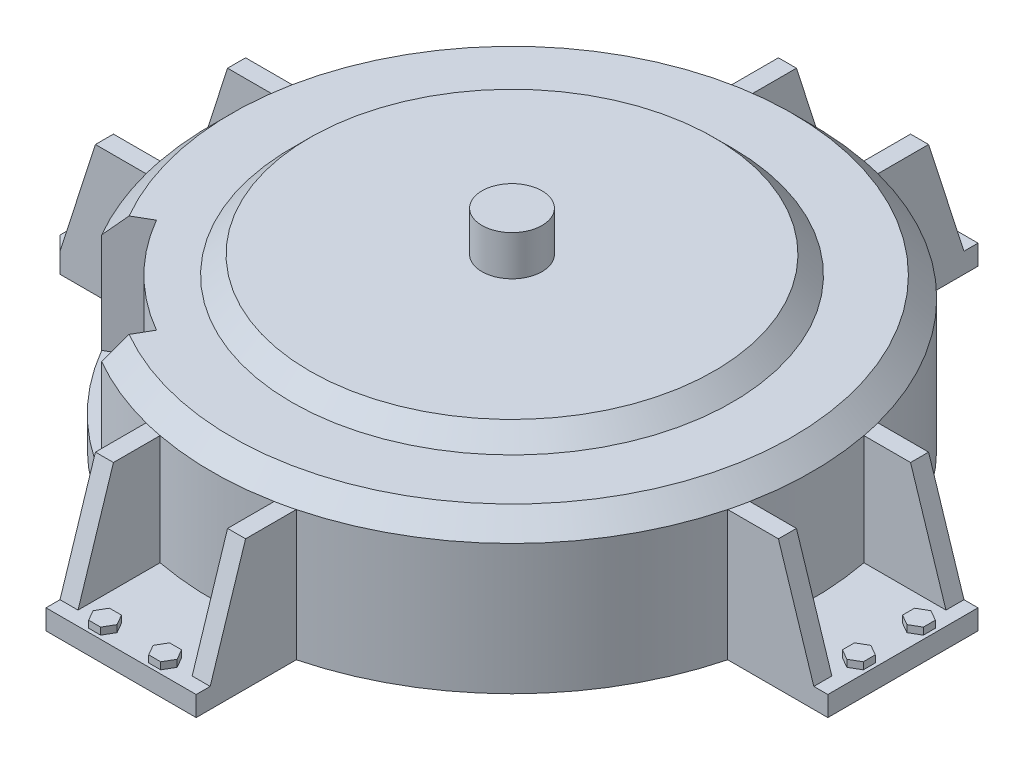
from build123d import *

# Parameters (mm, degrees)
SKETCH2_R                = 150
BOSS_EXTRUDE1_DEPTH      = 75
CHAMFER1_SIZE            = 10
BOSS_EXTRUDE2_START      = -75
BOSS_EXTRUDE2_DEPTH      = 10
CHAMFER2_SIZE            = 7
BOSS_EXTRUDE3_DEPTH      = 9
BOSS_EXTRUDE4_DEPTH      = 3.5
CIRPATTERN1_COUNT        = 4
CIRPATTERN1_COPY_1_DEPTH = 9
CIRPATTERN1_COPY_2_DEPTH = 9
CIRPATTERN1_COPY_3_DEPTH = 9
CIRPATTERN1_COPY_4_DEPTH = 3.5
CIRPATTERN1_COPY_5_DEPTH = 3.5
CIRPATTERN1_COPY_6_DEPTH = 3.5
CUT_EXTRUDE2_START       = -60
CUT_EXTRUDE2_DEPTH       = 60
SKETCH8_R                = 110
BOSS_EXTRUDE5_DEPTH      = 9
BOSS_EXTRUDE5_TAPER      = 45
SKETCH9_R                = 15
BOSS_EXTRUDE6_DEPTH      = 20


with BuildPart() as part:
    # Sketch2 → Boss-Extrude1 (new body)
    with BuildSketch(Plane(origin=(0, 0, 0), x_dir=(1, 0, 0), z_dir=(0, 1, 0))):
        with Locations(Location((0, 0, 0), (0, 0, 270))):
            Circle(SKETCH2_R)
    extrude(amount=BOSS_EXTRUDE1_DEPTH)

    # Chamfer1
    chamfer1_edges = [part.edges().sort_by_distance(p)[0] for p in [
        (0, 75, -150),
    ]]
    chamfer(chamfer1_edges, length=CHAMFER1_SIZE)

    # Sketch3 → Boss-Extrude2 (add)
    with BuildSketch(Plane(origin=(0, 75, 0), x_dir=(1, 0, 0), z_dir=(0, 1, 0)).offset(BOSS_EXTRUDE2_START)):
        with BuildLine():
            Line((-145.236875483, 37.5), (-195.236875483, 37.5))
            Line((-195.236875483, 37.5), (-195.236875483, -37.5))
            Line((-195.236875483, -37.5), (-145.236875483, -37.5))
            ThreePointArc((-145.236875483, -37.5), (-150, 0), (-145.236875483, 37.5))
        make_face()
    boss_extrude2 = extrude(amount=BOSS_EXTRUDE2_DEPTH)

    # Chamfer2
    chamfer2_edges = [part.edges().sort_by_distance(p)[0] for p in [
        (-195.236875483, 5, -37.5),
        (-195.236875483, 5, 37.5),
    ]]
    chamfer(chamfer2_edges, length=CHAMFER2_SIZE)

    # Sketch5 → Boss-Extrude3 (add)
    with BuildSketch(Plane.XY.offset(37.5)):
        Polygon((-145.236875483, 10), (-145.236875483, 65), (-170.556875483, 65), (-188.236875483, 10), align=None)
    boss_extrude3 = extrude(amount=-BOSS_EXTRUDE3_DEPTH)

    # Sketch6 → Boss-Extrude4 (add)
    with BuildSketch(Plane(origin=(0, 10, 0), x_dir=(1, 0, 0), z_dir=(0, 1, 0))):
        Polygon((-183.04072306, -18), (-183.04072306, -12), (-188.236875483, -9), (-193.433027905, -12), (-193.433027905, -18), (-188.236875483, -21), align=None)
    boss_extrude4 = extrude(amount=BOSS_EXTRUDE4_DEPTH)

    # Mirror1: Boss-Extrude3, Boss-Extrude4 across plane
    add(boss_extrude3.mirror(Plane.XY))
    add(boss_extrude4.mirror(Plane.XY))

    # CirPattern1: Boss-Extrude2, Boss-Extrude3, Boss-Extrude4 ×4 about axis
    cirpattern1_axis = Axis((0, 0, 0), (0, 1, 0))
    add([boss_extrude2.rotate(cirpattern1_axis, i * 360 / CIRPATTERN1_COUNT) for i in range(1, CIRPATTERN1_COUNT)])
    add([boss_extrude3.rotate(cirpattern1_axis, i * 360 / CIRPATTERN1_COUNT) for i in range(1, CIRPATTERN1_COUNT)])
    add([boss_extrude4.rotate(cirpattern1_axis, i * 360 / CIRPATTERN1_COUNT) for i in range(1, CIRPATTERN1_COUNT)])

    # CirPattern1 copy 1 sketch → CirPattern1 copy 1 (add)
    with BuildSketch(Plane(origin=(-37.5, 0, 0), x_dir=(0, 0, -1), z_dir=(-1, 0, 0))):
        Polygon((-145.236875483, -10), (-145.236875483, -65), (-170.556875483, -65), (-188.236875483, -10), align=None)
    extrude(amount=-CIRPATTERN1_COPY_1_DEPTH)

    # CirPattern1 copy 2 sketch → CirPattern1 copy 2 (add)
    with BuildSketch(Plane(origin=(0, 0, 37.5), x_dir=(-1, 0, 0), z_dir=(0, 0, 1))):
        Polygon((-145.236875483, -10), (-145.236875483, -65), (-170.556875483, -65), (-188.236875483, -10), align=None)
    extrude(amount=-CIRPATTERN1_COPY_2_DEPTH)

    # CirPattern1 copy 3 sketch → CirPattern1 copy 3 (add)
    with BuildSketch(Plane(origin=(37.5, 0, 0), x_dir=(0, 0, 1), z_dir=(1, 0, 0))):
        Polygon((-145.236875483, -10), (-145.236875483, -65), (-170.556875483, -65), (-188.236875483, -10), align=None)
    extrude(amount=-CIRPATTERN1_COPY_3_DEPTH)

    # CirPattern1 copy 4 sketch → CirPattern1 copy 4 (add)
    with BuildSketch(Plane(origin=(0, 10, 0), x_dir=(0, 0, -1), z_dir=(0, 1, 0))):
        Polygon((-183.04072306, 18), (-183.04072306, 12), (-188.236875483, 9), (-193.433027905, 12), (-193.433027905, 18), (-188.236875483, 21), align=None)
    extrude(amount=CIRPATTERN1_COPY_4_DEPTH)

    # CirPattern1 copy 5 sketch → CirPattern1 copy 5 (add)
    with BuildSketch(Plane(origin=(0, 10, 0), x_dir=(-1, 0, 0), z_dir=(0, 1, 0))):
        Polygon((-183.04072306, 18), (-183.04072306, 12), (-188.236875483, 9), (-193.433027905, 12), (-193.433027905, 18), (-188.236875483, 21), align=None)
    extrude(amount=CIRPATTERN1_COPY_5_DEPTH)

    # CirPattern1 copy 6 sketch → CirPattern1 copy 6 (add)
    with BuildSketch(Plane.ZX.offset(10)):
        Polygon((-183.04072306, 18), (-183.04072306, 12), (-188.236875483, 9), (-193.433027905, 12), (-193.433027905, 18), (-188.236875483, 21), align=None)
    extrude(amount=CIRPATTERN1_COPY_6_DEPTH)

    # Sketch7 → Cut-Extrude2 (cut)
    with BuildSketch(Plane(origin=(0, 75, 0), x_dir=(1, 0, 0), z_dir=(0, 1, 0)).offset(CUT_EXTRUDE2_START)):
        with BuildLine():
            ThreePointArc((-70, -121.24355653), (-98.994949366, -98.994949366), (-121.24355653, -70))
            Line((-121.24355653, -70), (-129.903810568, -75))
            ThreePointArc((-129.903810568, -75), (-106.066017178, -106.066017178), (-75, -129.903810568))
            Line((-75, -129.903810568), (-70, -121.24355653))
        make_face()
        with BuildLine():
            ThreePointArc((-65, -112.583302492), (-91.923881554, -91.923881554), (-112.583302492, -65))
            Line((-112.583302492, -65), (-121.24355653, -70))
            ThreePointArc((-121.24355653, -70), (-98.994949366, -98.994949366), (-70, -121.24355653))
            Line((-70, -121.24355653), (-65, -112.583302492))
        make_face()
    extrude(amount=CUT_EXTRUDE2_DEPTH, mode=Mode.SUBTRACT)

    # Sketch8 → Boss-Extrude5 (add)
    with BuildSketch(Plane(origin=(0, 75, 0), x_dir=(1, 0, 0), z_dir=(0, 1, 0))):
        Circle(SKETCH8_R)
    extrude(amount=BOSS_EXTRUDE5_DEPTH, taper=BOSS_EXTRUDE5_TAPER)

    # Sketch9 → Boss-Extrude6 (add)
    with BuildSketch(Plane(origin=(0, 84, 0), x_dir=(1, 0, 0), z_dir=(0, 1, 0))):
        with Locations(Location((0, 0, 0), (0, 0, 270))):
            Circle(SKETCH9_R)
    extrude(amount=BOSS_EXTRUDE6_DEPTH)


solid = part.part
